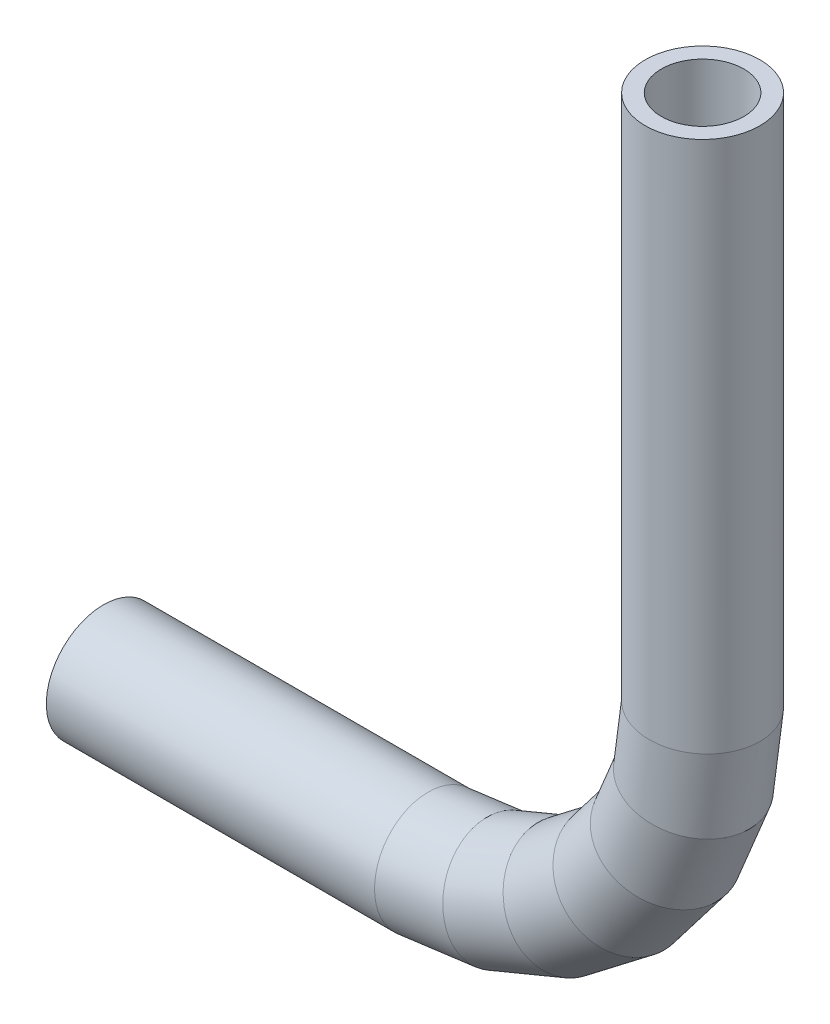
from build123d import *

# Parameters (mm, degrees)
PROFILE_R   = 3.175
PROFILE_R_2 = 2.286


with BuildPart() as part:
    # Tube: sweep along a curve in space
    with BuildLine() as tube_path:
        Line((-520.7, 36, 0), (-502.5, 36, 0))
        Line((-502.5, 36, 0), (-498.617714323, 36.511112606, 0))
        Line((-498.617714323, 36.511112606, 0), (-495, 38.009618943, 0))
        Line((-495, 38.009618943, 0), (-491.893398282, 40.393398282, 0))
        Line((-491.893398282, 40.393398282, 0), (-489.509618943, 43.5, 0))
        Line((-489.509618943, 43.5, 0), (-488.011112606, 47.117714323, 0))
        Line((-488.011112606, 47.117714323, 0), (-487.5, 51, 0))
        Line((-487.5, 51, 0), (-487.5, 80.35, 0))
    # Profile → Tube (sweep)
    with BuildSketch(Plane(origin=(-520.7, 0, 0), x_dir=(0, 0, -1), z_dir=(1, 0, 0))):
        with Locations((0, 36)):
            Circle(PROFILE_R)
        with Locations((0, 36)):
            Circle(PROFILE_R_2, mode=Mode.SUBTRACT)
    sweep(path=tube_path.line, transition=Transition.RIGHT)


solid = part.part
